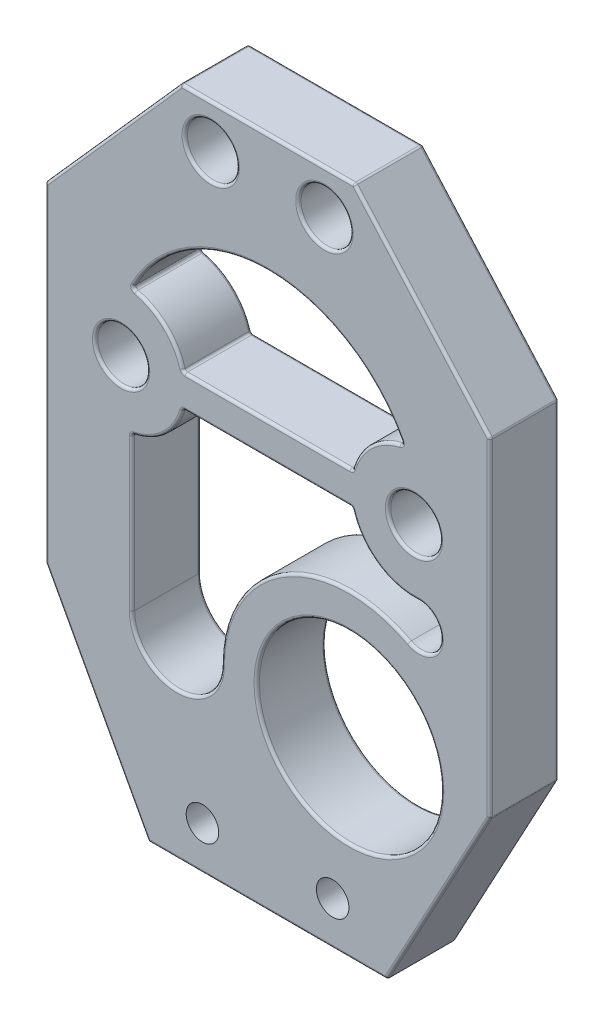
from build123d import *

# Parameters (mm, degrees)
ESBO_O1_R                = 2.395
ESBO_O1_R_2              = 1.5
ESBO_O1_R_3              = 8.5
RESSALTO_EXTRUS_O1_DEPTH = 6.35
FILETE1_R                = 0.25


with BuildPart() as part:
    # Esboço1 → Ressalto-extrusão1 (new body)
    with BuildSketch(Plane.XY):
        Polygon((-7.99, 62), (7.99, 62), (20.5, 47.9), (20.5, 17.6), (11, 0), (-11, 0), (-20.5, 17.6), (-20.5, 47.9), align=None)
        with Locations((5.24, 58)):
            Circle(ESBO_O1_R, mode=Mode.SUBTRACT)
        with Locations((-5.24, 58)):
            Circle(ESBO_O1_R, mode=Mode.SUBTRACT)
        with Locations((6, 4)):
            Circle(ESBO_O1_R_2, mode=Mode.SUBTRACT)
        with Locations((-6, 4)):
            Circle(ESBO_O1_R_2, mode=Mode.SUBTRACT)
        with Locations((7.5, 17.6)):
            Circle(ESBO_O1_R_3, mode=Mode.SUBTRACT)
        with Locations((13.5, 37.6)):
            Circle(ESBO_O1_R, mode=Mode.SUBTRACT)
        with Locations((-13.5, 37.6)):
            Circle(ESBO_O1_R, mode=Mode.SUBTRACT)
        with BuildLine():
            Line((-7.793862953, 39.1), (7.793862953, 39.1))
            ThreePointArc((7.793862953, 39.1), (9.511169252, 41.94732438), (12.495413112, 43.413845989))
            ThreePointArc((12.495413112, 43.413845989), (0, 51.1), (-12.495413112, 43.413845989))
            ThreePointArc((-12.495413112, 43.413845989), (-9.511169252, 41.94732438), (-7.793862953, 39.1))
        make_face(mode=Mode.SUBTRACT)
        with BuildLine():
            Line((-12.495413112, 31.786154011), (-12.495413112, 17.6))
            ThreePointArc((-12.495413112, 17.6), (-8.36, 13.464586888), (-4.224586888, 17.6))
            ThreePointArc((-4.224586888, 17.6), (1.465365447, 27.652319311), (13.012544702, 27.947839804))
            ThreePointArc((13.012544702, 27.947839804), (15.906382409, 29.2842218), (13.838229798, 31.709702842))
            ThreePointArc((13.838229798, 31.709702842), (10.032683409, 32.826351955), (7.793862953, 36.1))
            Line((7.793862953, 36.1), (-7.793862953, 36.1))
            ThreePointArc((-7.793862953, 36.1), (-9.511169252, 33.25267562), (-12.495413112, 31.786154011))
        make_face(mode=Mode.SUBTRACT)
    extrude(amount=RESSALTO_EXTRUS_O1_DEPTH)

    # Filete1
    filete1_edges = [part.edges().sort_by_distance(p)[0] for p in [
        (0, 0, 0),
        (-15.75, 8.8, 0),
        (-20.5, 32.75, 0),
        (-14.245, 54.95, 0),
        (-15.75, 8.8, 6.35),
        (-7.99, 62, 3.175),
        (7.99, 62, 3.175),
        (20.5, 47.9, 3.175),
        (20.5, 17.6, 3.175),
        (11, 0, 3.175),
        (-11, 0, 3.175),
        (-20.5, 17.6, 3.175),
        (-20.5, 47.9, 3.175),
        (0, 0, 6.35),
        (15.75, 8.8, 6.35),
        (-7.635, 58, 0),
        (-7.635, 58, 6.35),
        (20.5, 32.75, 6.35),
        (2.845, 58, 0),
        (2.845, 58, 6.35),
        (14.245, 54.95, 6.35),
        (0, 62, 6.35),
        (-1, 17.6, 0),
        (-1, 17.6, 6.35),
        (11.105, 37.6, 0),
        (11.105, 37.6, 6.35),
        (-15.895, 37.6, 0),
        (-15.895, 37.6, 6.35),
        (-14.245, 54.95, 6.35),
        (-9.511169252, 41.94732438, 0),
        (-12.495413112, 43.413845989, 3.175),
        (0, 39.1, 0),
        (-7.793862953, 39.1, 3.175),
        (9.511169252, 41.94732438, 0),
        (7.793862953, 39.1, 3.175),
        (0, 51.1, 0),
        (12.495413112, 43.413845989, 3.175),
        (-9.511169252, 41.94732438, 6.35),
        (0, 39.1, 6.35),
        (9.511169252, 41.94732438, 6.35),
        (0, 51.1, 6.35),
        (-9.511169252, 33.25267562, 0),
        (-7.793862953, 36.1, 3.175),
        (-12.495413112, 24.693077006, 0),
        (-12.495413112, 31.786154011, 3.175),
        (-8.36, 13.464586888, 0),
        (1.465365447, 27.652319311, 0),
        (15.906382409, 29.2842218, 0),
        (10.032683409, 32.826351955, 0),
        (0, 36.1, 0),
        (7.793862953, 36.1, 3.175),
        (-9.511169252, 33.25267562, 6.35),
        (-12.495413112, 24.693077006, 6.35),
        (-8.36, 13.464586888, 6.35),
        (1.465365447, 27.652319311, 6.35),
        (15.906382409, 29.2842218, 6.35),
        (10.032683409, 32.826351955, 6.35),
        (0, 36.1, 6.35),
        (0, 62, 0),
        (-20.5, 32.75, 6.35),
        (14.245, 54.95, 0),
        (20.5, 32.75, 0),
        (15.75, 8.8, 0),
    ]]
    fillet(filete1_edges, radius=FILETE1_R)


solid = part.part
